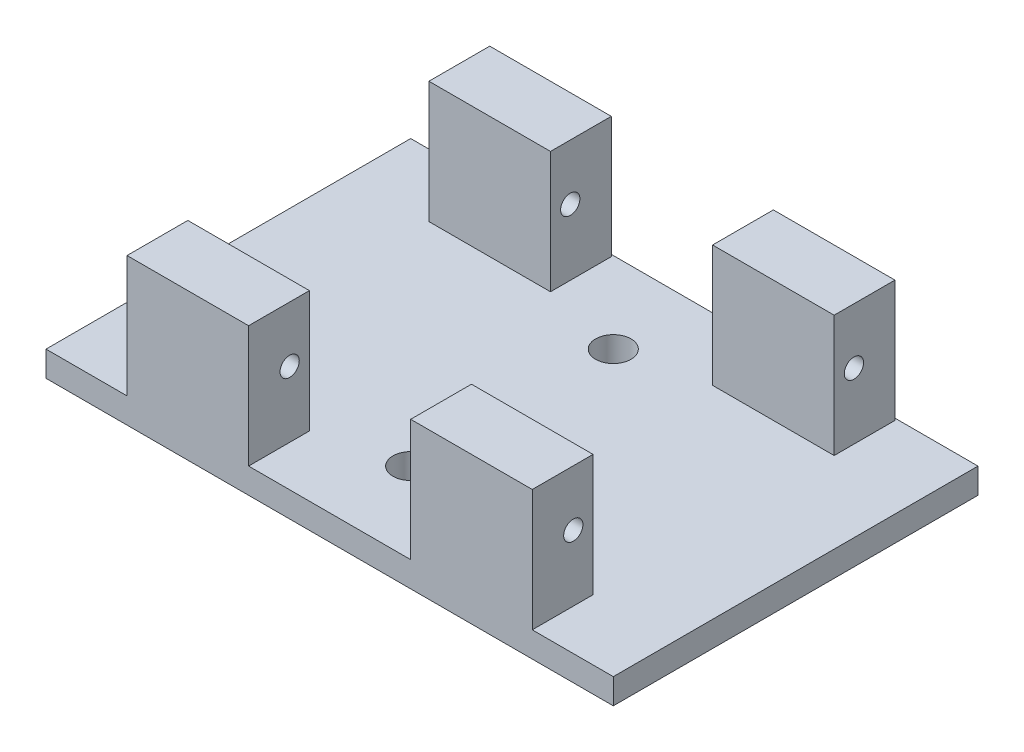
from build123d import *

# Parameters (mm, degrees)
SKETCH_1_W          = 56
SKETCH_1_H          = 36
EXTRUDE_1_DEPTH     = 2.5
SKETCH_2_W          = 12
SKETCH_2_H          = 6
EXTRUDE_2_DEPTH     = 12
SKETCH_3_R          = 0.95
CUT_EXTRUDE_1_DEPTH = 54.275228765
SKETCH_4_R          = 1.75
CUT_EXTRUDE_2_DEPTH = 36.383612026


with BuildPart() as part:
    # 草图1 → 凸台-拉伸1 (new body)
    with BuildSketch(Plane(origin=(0, 0, 0), x_dir=(1, 0, 0), z_dir=(0, 1, 0))):
        Rectangle(SKETCH_1_W, SKETCH_1_H)
    extrude(amount=EXTRUDE_1_DEPTH)

    # 草图2 → 凸台-拉伸2 (add)
    with BuildSketch(Plane(origin=(0, 2.5, 0), x_dir=(1, 0, 0), z_dir=(0, 1, 0))):
        with Locations((14, 14.8)):
            Rectangle(SKETCH_2_W, SKETCH_2_H)
        with Locations((14, -15)):
            Rectangle(SKETCH_2_W, SKETCH_2_H)
    extrude_2 = extrude(amount=EXTRUDE_2_DEPTH)

    # 草图3 → 切除-拉伸1 (cut, through all)
    with BuildSketch(Plane(origin=(20, 0, 0), x_dir=(0, 0, -1), z_dir=(1, 0, 0))):
        with Locations((-13.95, 9)):
            Circle(SKETCH_3_R)
        with Locations((13.75, 9)):
            Circle(SKETCH_3_R)
    cut_extrude_1 = extrude(amount=-CUT_EXTRUDE_1_DEPTH, mode=Mode.SUBTRACT)

    # 镜向1: 凸台-拉伸2, 切除-拉伸1 across plane
    add(extrude_2.mirror(Plane(origin=(0, 0, 0), x_dir=(0, 0, 1), z_dir=(1, 0, 0))))
    add(cut_extrude_1.mirror(Plane(origin=(0, 0, 0), x_dir=(0, 0, 1), z_dir=(1, 0, 0))), mode=Mode.SUBTRACT)

    # 草图4 → 切除-拉伸2 (cut, through all)
    with BuildSketch(Plane(origin=(0, 2.5, 0), x_dir=(1, 0, 0), z_dir=(0, 1, 0))):
        with Locations(Location((0, -10, 0), (0, 0, 270))):
            Circle(SKETCH_4_R)
        with Locations(Location((0, 10, 0), (0, 0, 270))):
            Circle(SKETCH_4_R)
    extrude(amount=-CUT_EXTRUDE_2_DEPTH, mode=Mode.SUBTRACT)


solid = part.part
